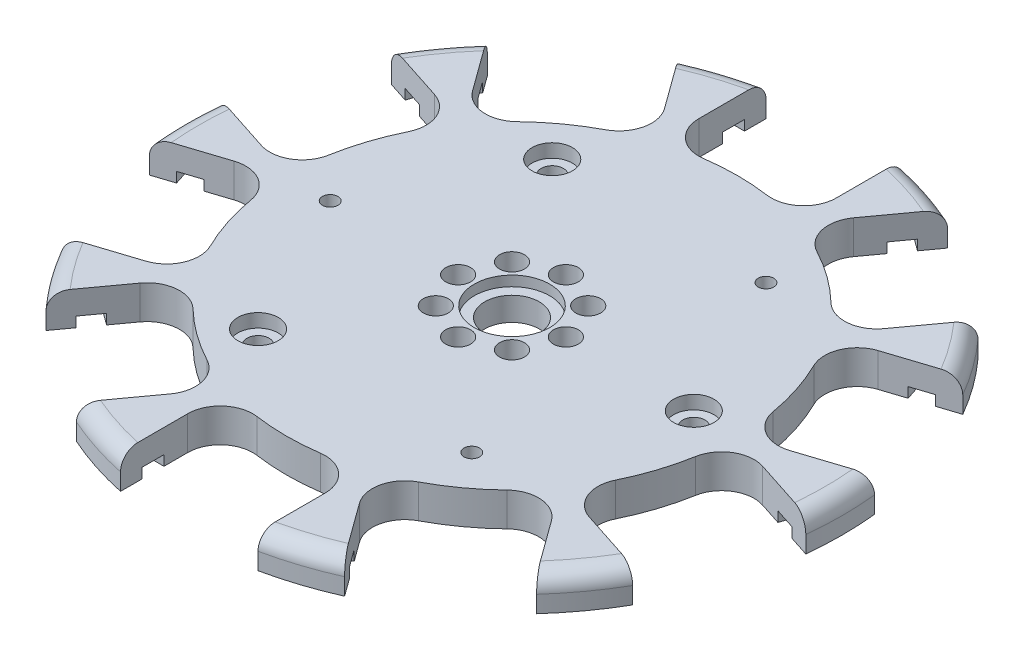
from build123d import *

# Parameters (mm, degrees)
SKETCH1_W                                        = 49
SKETCH1_H                                        = 5
CUT_EXTRUDE1_DEPTH                               = 70.476614771
CUT_EXTRUDE2_DEPTH                               = 70.476614771
CUT_EXTRUDE3_DEPTH                               = 70.476614771
CUT_EXTRUDE4_DEPTH                               = 70.476614771
CUT_EXTRUDE5_DEPTH                               = 70.476614771
CUT_EXTRUDE6_DEPTH                               = 70.476614771
CUT_EXTRUDE7_DEPTH                               = 69.723052719
CUT_EXTRUDE8_DEPTH                               = 69.723052719
CUT_EXTRUDE9_DEPTH                               = 69.723052719
CUT_EXTRUDE10_DEPTH                              = 69.723052719
SKETCH12_W                                       = 3.25
SKETCH12_H                                       = 1.5
CUT_EXTRUDE11_DEPTH                              = 2.772
SKETCH13_W                                       = 3.25
SKETCH13_H                                       = 1.5
CUT_EXTRUDE12_DEPTH                              = 2.772
SKETCH14_W                                       = 3.25
SKETCH14_H                                       = 1.5
CUT_EXTRUDE13_DEPTH                              = 2.772
SKETCH15_W                                       = 3.25
SKETCH15_H                                       = 1.5
CUT_EXTRUDE14_DEPTH                              = 2.772
SKETCH16_W                                       = 3.25
SKETCH16_H                                       = 1.5
CUT_EXTRUDE15_DEPTH                              = 2.772
SKETCH17_W                                       = 3.25
SKETCH17_H                                       = 1.5
CUT_EXTRUDE16_DEPTH                              = 2.772
SKETCH18_W                                       = 3.25
SKETCH18_H                                       = 1.5
CUT_EXTRUDE17_DEPTH                              = 2.772
SKETCH19_W                                       = 3.25
SKETCH19_H                                       = 1.5
CUT_EXTRUDE18_DEPTH                              = 2.772
SKETCH20_W                                       = 3.25
SKETCH20_H                                       = 1.5
CUT_EXTRUDE19_DEPTH                              = 2.772
SKETCH21_W                                       = 3.25
SKETCH21_H                                       = 1.5
CUT_EXTRUDE20_DEPTH                              = 2.772
SKETCH22_W                                       = 3.25
SKETCH22_H                                       = 1.5
CUT_EXTRUDE21_DEPTH                              = 2.772
SKETCH23_W                                       = 3.25
SKETCH23_H                                       = 1.5
CUT_EXTRUDE22_DEPTH                              = 2.772
SKETCH24_W                                       = 3.25
SKETCH24_H                                       = 1.5
CUT_EXTRUDE23_DEPTH                              = 2.772
SKETCH25_W                                       = 3.25
SKETCH25_H                                       = 1.5
CUT_EXTRUDE24_DEPTH                              = 2.772
SKETCH26_W                                       = 3.25
SKETCH26_H                                       = 1.5
CUT_EXTRUDE25_DEPTH                              = 2.772
SKETCH27_W                                       = 3.25
SKETCH27_H                                       = 1.5
CUT_EXTRUDE26_DEPTH                              = 2.772
SKETCH28_W                                       = 3.25
SKETCH28_H                                       = 1.5
CUT_EXTRUDE27_DEPTH                              = 2.772
SKETCH29_W                                       = 3.25
SKETCH29_H                                       = 1.5
CUT_EXTRUDE28_DEPTH                              = 2.772
SKETCH30_W                                       = 3.25
SKETCH30_H                                       = 1.5
CUT_EXTRUDE29_DEPTH                              = 2.772
SKETCH31_W                                       = 3.25
SKETCH31_H                                       = 1.5
CUT_EXTRUDE30_DEPTH                              = 2.772
F_2_3_2_3_DIAMETER_HOLE1_D                       = 2.3
F_3_7_3_7_DIAMETER_HOLE1_D                       = 3.7
CBORE_FOR_M3_HEX_HEAD_MACHINE_SCREW1_D           = 3.3
CBORE_FOR_M3_HEX_HEAD_MACHINE_SCREW1_CBORE_D     = 6
CBORE_FOR_M3_HEX_HEAD_MACHINE_SCREW1_CBORE_DEPTH = 2
HOLE1_D                                          = 8.1
HOLE1_CBORE_D                                    = 11.2
HOLE1_CBORE_DEPTH                                = 1.5
FILLET1_R                                        = 2.5
FILLET2_R                                        = 4.827


with BuildPart() as part:
    # Sketch1 → Revolve1 (revolve)
    with BuildSketch(Plane(origin=(0, 0, 0), x_dir=(-1, 0, 0), z_dir=(0, 0, -1)), mode=Mode.PRIVATE) as revolve1_sk:
        with Locations((-24.5, 2.5)):
            Rectangle(SKETCH1_W, SKETCH1_H)
    revolve(revolve1_sk.sketch.rotate(Axis((0, 0, 0), (0, 1, 0)), 270), axis=Axis((0, 0, 0), (0, 1, 0)))

    # Sketch2 → Cut-Extrude1 (cut, through all)
    with BuildSketch(Plane.XZ):
        with BuildLine():
            Line((-10.205, 47.925546163), (-10.205, 31.907804296))
            ThreePointArc((-10.205, 31.907804296), (0, 33.5), (10.205, 31.907804296))
            Line((10.205, 31.907804296), (10.205, 47.925546163))
            ThreePointArc((10.205, 47.925546163), (0, 49), (-10.205, 47.925546163))
        make_face()
    extrude(amount=-CUT_EXTRUDE1_DEPTH, mode=Mode.SUBTRACT)

    # Sketch3 → Cut-Extrude2 (cut, through all)
    with BuildSketch(Plane.XZ):
        with BuildLine():
            Line((19.913910815, 44.77092981), (10.498918371, 31.812304428))
            ThreePointArc((10.498918371, 31.812304428), (19.690805952, 27.102069312), (27.010955226, 19.815607429))
            Line((27.010955226, 19.815607429), (36.42594767, 32.774232811))
            ThreePointArc((36.42594767, 32.774232811), (28.801477362, 39.641832724), (19.913910815, 44.77092981))
        make_face()
    extrude(amount=-CUT_EXTRUDE2_DEPTH, mode=Mode.SUBTRACT)

    # Sketch4 → Cut-Extrude3 (cut, through all)
    with BuildSketch(Plane.XZ):
        with BuildLine():
            Line((42.426384548, 24.515339978), (27.192606769, 19.565585529))
            ThreePointArc((27.192606769, 19.565585529), (31.860393296, 10.352069312), (33.499643624, 0.154522032))
            Line((33.499643624, 0.154522032), (48.733421403, 5.10427648))
            ThreePointArc((48.733421403, 5.10427648), (46.601769298, 15.141832724), (42.426384548, 24.515339978))
        make_face()
    extrude(amount=-CUT_EXTRUDE3_DEPTH, mode=Mode.SUBTRACT)

    # Sketch5 → Cut-Extrude4 (cut, through all)
    with BuildSketch(Plane.XZ):
        with BuildLine():
            Line((48.733421403, -5.10427648), (33.499643624, -0.154522032))
            ThreePointArc((33.499643624, -0.154522032), (31.860393296, -10.352069312), (27.192606769, -19.565585529))
            Line((27.192606769, -19.565585529), (42.426384548, -24.515339978))
            ThreePointArc((42.426384548, -24.515339978), (46.601769298, -15.141832724), (48.733421403, -5.10427648))
        make_face()
    extrude(amount=-CUT_EXTRUDE4_DEPTH, mode=Mode.SUBTRACT)

    # Sketch6 → Cut-Extrude5 (cut, through all)
    with BuildSketch(Plane.XZ):
        with BuildLine():
            Line((36.42594767, -32.774232811), (27.010955226, -19.815607429))
            ThreePointArc((27.010955226, -19.815607429), (19.690805952, -27.102069312), (10.498918371, -31.812304428))
            Line((10.498918371, -31.812304428), (19.913910815, -44.77092981))
            ThreePointArc((19.913910815, -44.77092981), (28.801477362, -39.641832724), (36.42594767, -32.774232811))
        make_face()
    extrude(amount=-CUT_EXTRUDE5_DEPTH, mode=Mode.SUBTRACT)

    # Sketch7 → Cut-Extrude6 (cut, through all)
    with BuildSketch(Plane.XZ):
        with BuildLine():
            Line((10.205, -47.925546163), (10.205, -31.907804296))
            ThreePointArc((10.205, -31.907804296), (0, -33.5), (-10.205, -31.907804296))
            Line((-10.205, -31.907804296), (-10.205, -47.925546163))
            ThreePointArc((-10.205, -47.925546163), (0, -49), (10.205, -47.925546163))
        make_face()
    extrude(amount=-CUT_EXTRUDE6_DEPTH, mode=Mode.SUBTRACT)

    # Sketch8 → Cut-Extrude7 (cut, through all)
    with BuildSketch(Plane.XZ):
        with BuildLine():
            Line((-19.913910815, -44.77092981), (-10.498918371, -31.812304428))
            ThreePointArc((-10.498918371, -31.812304428), (-19.690805952, -27.102069312), (-27.010955226, -19.815607429))
            Line((-27.010955226, -19.815607429), (-36.42594767, -32.774232811))
            ThreePointArc((-36.42594767, -32.774232811), (-28.801477362, -39.641832724), (-19.913910815, -44.77092981))
        make_face()
    extrude(amount=-CUT_EXTRUDE7_DEPTH, mode=Mode.SUBTRACT)

    # Sketch9 → Cut-Extrude8 (cut, through all)
    with BuildSketch(Plane.XZ):
        with BuildLine():
            Line((-42.426384548, -24.515339978), (-27.192606769, -19.565585529))
            ThreePointArc((-27.192606769, -19.565585529), (-31.860393296, -10.352069312), (-33.499643624, -0.154522032))
            Line((-33.499643624, -0.154522032), (-48.733421403, -5.10427648))
            ThreePointArc((-48.733421403, -5.10427648), (-46.601769298, -15.141832724), (-42.426384548, -24.515339978))
        make_face()
    extrude(amount=-CUT_EXTRUDE8_DEPTH, mode=Mode.SUBTRACT)

    # Sketch10 → Cut-Extrude9 (cut, through all)
    with BuildSketch(Plane.XZ):
        with BuildLine():
            Line((-48.733421403, 5.10427648), (-33.499643624, 0.154522032))
            ThreePointArc((-33.499643624, 0.154522032), (-31.860393296, 10.352069312), (-27.192606769, 19.565585529))
            Line((-27.192606769, 19.565585529), (-42.426384548, 24.515339978))
            ThreePointArc((-42.426384548, 24.515339978), (-46.601769298, 15.141832724), (-48.733421403, 5.10427648))
        make_face()
    extrude(amount=-CUT_EXTRUDE9_DEPTH, mode=Mode.SUBTRACT)

    # Sketch11 → Cut-Extrude10 (cut, through all)
    with BuildSketch(Plane.XZ):
        with BuildLine():
            Line((-36.42594767, 32.774232811), (-27.010955226, 19.815607429))
            ThreePointArc((-27.010955226, 19.815607429), (-19.690805952, 27.102069312), (-10.498918371, 31.812304428))
            Line((-10.498918371, 31.812304428), (-19.913910815, 44.77092981))
            ThreePointArc((-19.913910815, 44.77092981), (-28.801477362, 39.641832724), (-36.42594767, 32.774232811))
        make_face()
    extrude(amount=-CUT_EXTRUDE10_DEPTH, mode=Mode.SUBTRACT)

    # Sketch12 → Cut-Extrude11 (cut)
    with BuildSketch(Plane(origin=(8.256018428, 0, 5.9983485), x_dir=(-0.5877852522924996, 0, 0.8090169943749284), z_dir=(-0.8090169943749282, 0, -0.5877852522924994))):
        with Locations((43.105, 0.75)):
            Rectangle(SKETCH12_W, SKETCH12_H)
    extrude(amount=-CUT_EXTRUDE11_DEPTH, mode=Mode.SUBTRACT)

    # Sketch13 → Cut-Extrude12 (cut)
    with BuildSketch(Plane(origin=(-10.205, 0, 0), x_dir=(0, 0, -1), z_dir=(1, 0, 0))):
        with Locations((-43.105, 0.75)):
            Rectangle(SKETCH13_W, SKETCH13_H)
    extrude(amount=-CUT_EXTRUDE12_DEPTH, mode=Mode.SUBTRACT)

    # Sketch14 → Cut-Extrude13 (cut)
    with BuildSketch(Plane.ZY.offset(-10.205)):
        with Locations((43.105, 0.75)):
            Rectangle(SKETCH14_W, SKETCH14_H)
    extrude(amount=-CUT_EXTRUDE13_DEPTH, mode=Mode.SUBTRACT)

    # Sketch15 → Cut-Extrude14 (cut)
    with BuildSketch(Plane(origin=(-8.256018428, 0, 5.9983485), x_dir=(-0.5877852522925132, 0, -0.8090169943749184), z_dir=(0.8090169943749185, 0, -0.5877852522925132))):
        with Locations((-43.105, 0.75)):
            Rectangle(SKETCH15_W, SKETCH15_H)
    extrude(amount=-CUT_EXTRUDE14_DEPTH, mode=Mode.SUBTRACT)

    # Sketch16 → Cut-Extrude15 (cut)
    with BuildSketch(Plane(origin=(8.256018428, 0, -5.9983485), x_dir=(0.587785252292494, 0, 0.8090169943749324), z_dir=(-0.8090169943749322, 0, 0.5877852522924939))):
        with Locations((43.105, 0.75)):
            Rectangle(SKETCH16_W, SKETCH16_H)
    extrude(amount=-CUT_EXTRUDE15_DEPTH, mode=Mode.SUBTRACT)

    # Sketch17 → Cut-Extrude16 (cut)
    with BuildSketch(Plane(origin=(-3.153518428, 0, 9.705531749), x_dir=(-0.951056516295172, 0, -0.3090169943748907), z_dir=(0.3090169943748907, 0, -0.951056516295172))):
        with Locations((-43.105, 0.75)):
            Rectangle(SKETCH17_W, SKETCH17_H)
    extrude(amount=-CUT_EXTRUDE16_DEPTH, mode=Mode.SUBTRACT)

    # Sketch18 → Cut-Extrude17 (cut)
    with BuildSketch(Plane(origin=(3.153518428, 0, -9.705531749), x_dir=(0.9510565162951817, 0, 0.3090169943748608), z_dir=(-0.3090169943748608, 0, 0.9510565162951817))):
        with Locations((43.105, 0.75)):
            Rectangle(SKETCH18_W, SKETCH18_H)
    extrude(amount=-CUT_EXTRUDE17_DEPTH, mode=Mode.SUBTRACT)

    # Sketch19 → Cut-Extrude18 (cut)
    with BuildSketch(Plane(origin=(3.153518428, 0, 9.705531749), x_dir=(-0.9510565162951802, 0, 0.3090169943748657), z_dir=(-0.3090169943748657, 0, -0.9510565162951802))):
        with Locations((-43.105, 0.75)):
            Rectangle(SKETCH19_W, SKETCH19_H)
    extrude(amount=-CUT_EXTRUDE18_DEPTH, mode=Mode.SUBTRACT)

    # Sketch20 → Cut-Extrude19 (cut)
    with BuildSketch(Plane(origin=(-3.153518428, 0, -9.705531749), x_dir=(0.9510565162951685, 0, -0.30901699437490154), z_dir=(0.30901699437490154, 0, 0.9510565162951685))):
        with Locations((43.105, 0.75)):
            Rectangle(SKETCH20_W, SKETCH20_H)
    extrude(amount=-CUT_EXTRUDE19_DEPTH, mode=Mode.SUBTRACT)

    # Sketch21 → Cut-Extrude20 (cut)
    with BuildSketch(Plane(origin=(8.256018428, 0, 5.9983485), x_dir=(-0.587785252292499, 0, 0.8090169943749287), z_dir=(-0.8090169943749287, 0, -0.587785252292499))):
        with Locations((-43.105, 0.75)):
            Rectangle(SKETCH21_W, SKETCH21_H)
    extrude(amount=-CUT_EXTRUDE20_DEPTH, mode=Mode.SUBTRACT)

    # Sketch22 → Cut-Extrude21 (cut)
    with BuildSketch(Plane(origin=(-8.256018428, 0, -5.9983485), x_dir=(0.5877852522925143, 0, -0.8090169943749175), z_dir=(0.8090169943749175, 0, 0.5877852522925143))):
        with Locations((43.105, 0.75)):
            Rectangle(SKETCH22_W, SKETCH22_H)
    extrude(amount=-CUT_EXTRUDE21_DEPTH, mode=Mode.SUBTRACT)

    # Sketch23 → Cut-Extrude22 (cut)
    with BuildSketch(Plane.ZY.offset(-10.205)):
        with Locations((-43.105, 0.75)):
            Rectangle(SKETCH23_W, SKETCH23_H)
    extrude(amount=-CUT_EXTRUDE22_DEPTH, mode=Mode.SUBTRACT)

    # Sketch24 → Cut-Extrude23 (cut)
    with BuildSketch(Plane(origin=(-10.205, 0, 0), x_dir=(0, 0, -1), z_dir=(1, 0, 0))):
        with Locations((43.105, 0.75)):
            Rectangle(SKETCH24_W, SKETCH24_H)
    extrude(amount=-CUT_EXTRUDE23_DEPTH, mode=Mode.SUBTRACT)

    # Sketch25 → Cut-Extrude24 (cut)
    with BuildSketch(Plane(origin=(8.256018428, 0, -5.9983485), x_dir=(0.5877852522925132, 0, 0.8090169943749184), z_dir=(-0.8090169943749185, 0, 0.5877852522925132))):
        with Locations((-43.105, 0.75)):
            Rectangle(SKETCH25_W, SKETCH25_H)
    extrude(amount=-CUT_EXTRUDE24_DEPTH, mode=Mode.SUBTRACT)

    # Sketch26 → Cut-Extrude25 (cut)
    with BuildSketch(Plane(origin=(-8.256018428, 0, 5.9983485), x_dir=(-0.587785252292494, 0, -0.8090169943749324), z_dir=(0.8090169943749322, 0, -0.5877852522924939))):
        with Locations((43.105, 0.75)):
            Rectangle(SKETCH26_W, SKETCH26_H)
    extrude(amount=-CUT_EXTRUDE25_DEPTH, mode=Mode.SUBTRACT)

    # Sketch27 → Cut-Extrude26 (cut)
    with BuildSketch(Plane(origin=(3.153518428, 0, -9.705531749), x_dir=(0.951056516295172, 0, 0.3090169943748907), z_dir=(-0.3090169943748907, 0, 0.951056516295172))):
        with Locations((-43.105, 0.75)):
            Rectangle(SKETCH27_W, SKETCH27_H)
    extrude(amount=-CUT_EXTRUDE26_DEPTH, mode=Mode.SUBTRACT)

    # Sketch28 → Cut-Extrude27 (cut)
    with BuildSketch(Plane(origin=(-3.153518428, 0, 9.705531749), x_dir=(-0.9510565162951815, 0, -0.3090169943748618), z_dir=(0.3090169943748618, 0, -0.9510565162951815))):
        with Locations((43.105, 0.75)):
            Rectangle(SKETCH28_W, SKETCH28_H)
    extrude(amount=-CUT_EXTRUDE27_DEPTH, mode=Mode.SUBTRACT)

    # Sketch29 → Cut-Extrude28 (cut)
    with BuildSketch(Plane(origin=(-3.153518428, 0, -9.705531749), x_dir=(0.951056516295172, 0, -0.3090169943748907), z_dir=(0.3090169943748907, 0, 0.951056516295172))):
        with Locations((-43.105, 0.75)):
            Rectangle(SKETCH29_W, SKETCH29_H)
    extrude(amount=-CUT_EXTRUDE28_DEPTH, mode=Mode.SUBTRACT)

    # Sketch30 → Cut-Extrude29 (cut)
    with BuildSketch(Plane(origin=(3.153518428, 0, 9.705531749), x_dir=(-0.9510565162951766, 0, 0.3090169943748764), z_dir=(-0.3090169943748764, 0, -0.9510565162951766))):
        with Locations((43.105, 0.75)):
            Rectangle(SKETCH30_W, SKETCH30_H)
    extrude(amount=-CUT_EXTRUDE29_DEPTH, mode=Mode.SUBTRACT)

    # Sketch31 → Cut-Extrude30 (cut)
    with BuildSketch(Plane(origin=(-8.256018428, 0, -5.9983485), x_dir=(0.5877852522925134, 0, -0.8090169943749181), z_dir=(0.8090169943749181, 0, 0.5877852522925134))):
        with Locations((-43.105, 0.75)):
            Rectangle(SKETCH31_W, SKETCH31_H)
    extrude(amount=-CUT_EXTRUDE30_DEPTH, mode=Mode.SUBTRACT)

    # Ø2.3 (2.3) Diameter Hole1 (through all)
    with Locations(Plane(origin=(0, 0, 0), x_dir=(-1, 0, 0), z_dir=(0, -1, 0))):
        with Locations((27, 0), (-15.870201812, 21.843458848), (-15.870201812, -21.843458848)):
            Hole(F_2_3_2_3_DIAMETER_HOLE1_D / 2)

    # Ø3.7 (3.7) Diameter Hole1 (through all)
    with Locations(Plane(origin=(0, 0, 0), x_dir=(-1, 0, 0), z_dir=(0, -1, 0))):
        with Locations((8, 0), (5.656854249, -5.656854249), (0, -8), (-5.656854249, -5.656854249), (-8, 0), (-5.656854249, 5.656854249), (0, 8), (5.656854249, 5.656854249)):
            Hole(F_3_7_3_7_DIAMETER_HOLE1_D / 2)

    # CBORE for M3 Hex Head Machine Screw1 (through all)
    with Locations(Plane(origin=(0, 5, 0), x_dir=(1, 0, 0), z_dir=(0, 1, 0))):
        with Locations((-15.870201812, 21.843458848), (-15.870201812, -21.843458848), (27, 0)):
            CounterBoreHole(CBORE_FOR_M3_HEX_HEAD_MACHINE_SCREW1_D / 2, CBORE_FOR_M3_HEX_HEAD_MACHINE_SCREW1_CBORE_D / 2, CBORE_FOR_M3_HEX_HEAD_MACHINE_SCREW1_CBORE_DEPTH)

    # Hole1 (through all)
    with Locations(Plane(origin=(0, 5, 0), x_dir=(1, 0, 0), z_dir=(0, 1, 0))):
        with Locations((0, 0)):
            CounterBoreHole(HOLE1_D / 2, HOLE1_CBORE_D / 2, HOLE1_CBORE_DEPTH)

    # Fillet1
    fillet1_edges = [part.edges().sort_by_distance(p)[0] for p in [
        (-39.641832724, 5, -28.801477362),
        (-49, 5, 0),
        (-39.641832724, 5, 28.801477362),
        (-15.141832724, 5, 46.601769298),
        (39.641832724, 5, 28.801477362),
        (15.141832724, 5, 46.601769298),
        (49, 5, 0),
        (39.641832724, 5, -28.801477362),
        (15.141832724, 5, -46.601769298),
        (-15.141832724, 5, -46.601769298),
    ]]
    fillet(fillet1_edges, radius=FILLET1_R)

    # Fillet2
    fillet2_edges = [part.edges().sort_by_distance(p)[0] for p in [
        (-27.010955226, 2.5, -19.815607429),
        (-10.498918371, 2.5, -31.812304428),
        (-33.499643624, 2.5, -0.154522032),
        (-27.192606769, 2.5, -19.565585529),
        (10.205, 2.5, 31.907804296),
        (-10.205, 2.5, 31.907804296),
        (-27.192606769, 2.5, 19.565585529),
        (-33.499643624, 2.5, 0.154522032),
        (-10.498918371, 2.5, 31.812304428),
        (-27.010955226, 2.5, 19.815607429),
        (27.010955226, 2.5, 19.815607429),
        (10.498918371, 2.5, 31.812304428),
        (33.499643624, 2.5, 0.154522032),
        (27.192606769, 2.5, 19.565585529),
        (27.192606769, 2.5, -19.565585529),
        (33.499643624, 2.5, -0.154522032),
        (10.498918371, 2.5, -31.812304428),
        (27.010955226, 2.5, -19.815607429),
        (-10.205, 2.5, -31.907804296),
        (10.205, 2.5, -31.907804296),
    ]]
    fillet(fillet2_edges, radius=FILLET2_R)


solid = part.part
